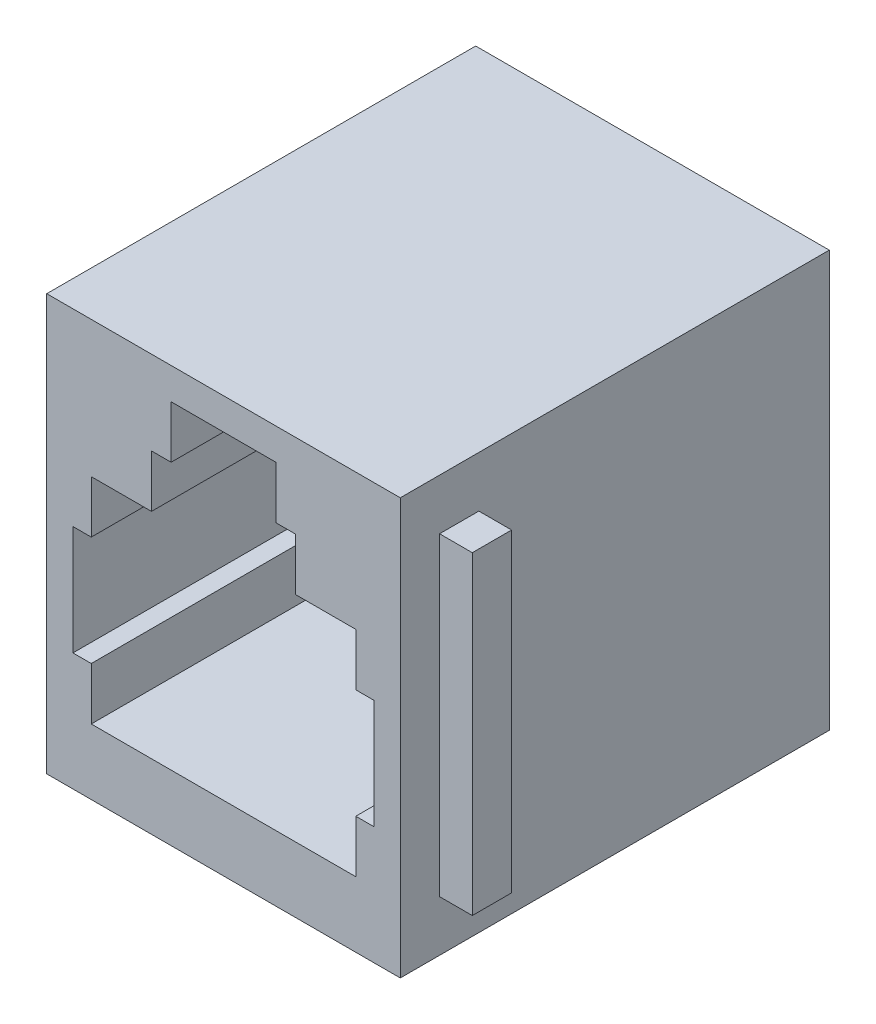
from build123d import *

# Parameters (mm, degrees)
SKETCH1_W           = 13.5
SKETCH1_H           = 15.88
BOSS_EXTRUDE1_DEPTH = 16.38
CUT_EXTRUDE1_DEPTH  = 15.38
SKETCH3_W           = 1.25
SKETCH3_H           = 1.5
BOSS_EXTRUDE2_DEPTH = 6


with BuildPart() as part:
    # Sketch1 → Boss-Extrude1 (new body)
    with BuildSketch(Plane.XY):
        Rectangle(SKETCH1_W, SKETCH1_H)
    extrude(amount=BOSS_EXTRUDE1_DEPTH)

    # Sketch2 → Cut-Extrude1 (cut)
    with BuildSketch(Plane.XY.offset(16.38)):
        Polygon((-2, 6.74), (2, 6.74), (2, 4.74), (2.75, 4.74), (2.75, 2.74), (5.05, 2.74), (5.05, 0.74), (5.75, 0.74), (5.75, -3.44), (5.05, -3.44), (5.05, -5.44), (-5.05, -5.44), (-5.05, -3.44), (-5.75, -3.44), (-5.75, 0.74), (-5.05, 0.74), (-5.05, 2.74), (-2.75, 2.74), (-2.75, 4.74), (-2, 4.74), align=None)
    extrude(amount=-CUT_EXTRUDE1_DEPTH, mode=Mode.SUBTRACT)

    # Sketch3 → Boss-Extrude2 (add, symmetric)
    with BuildSketch(Plane(origin=(0, 0, 0), x_dir=(1, 0, 0), z_dir=(0, 1, 0))):
        with Locations((7.375, -14.13)):
            Rectangle(SKETCH3_W, SKETCH3_H)
        with Locations((-7.375, -14.13)):
            Rectangle(SKETCH3_W, SKETCH3_H)
    extrude(amount=BOSS_EXTRUDE2_DEPTH, both=True)


solid = part.part
